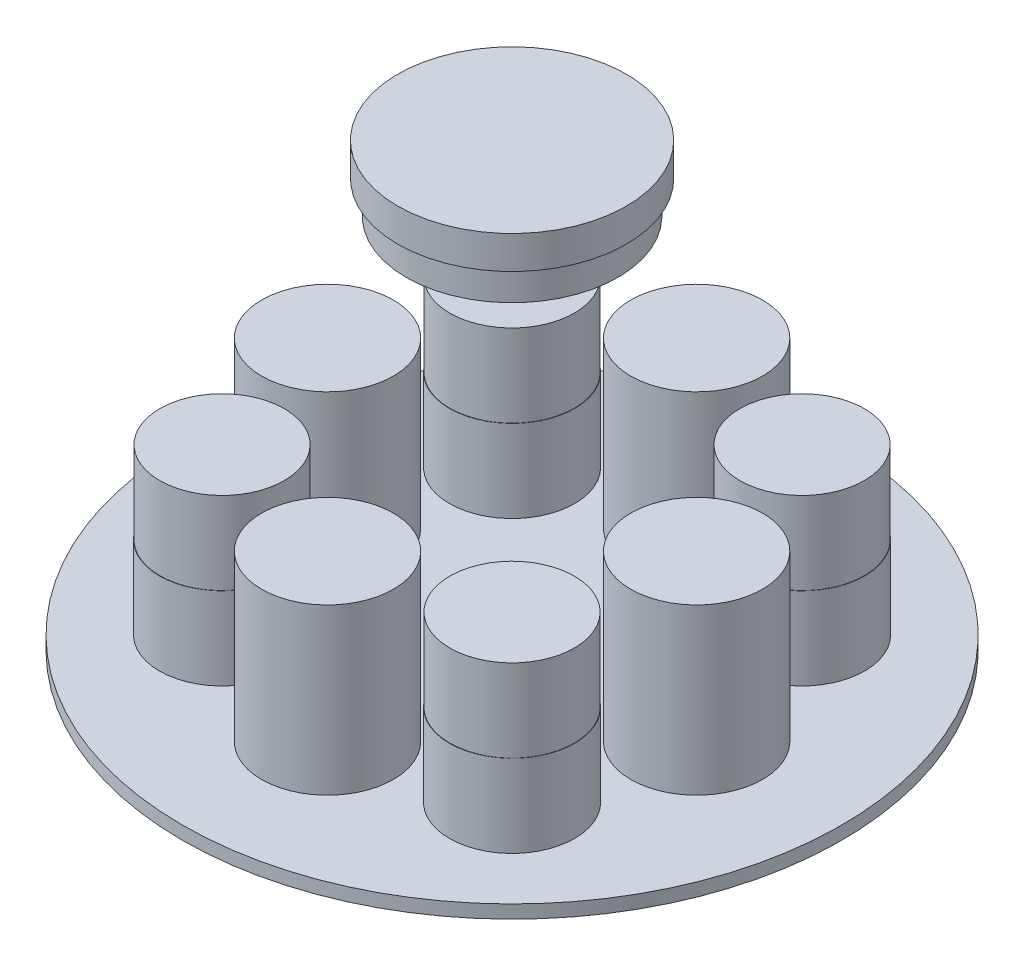
from build123d import *

# Parameters (mm, degrees)
SKETCH1_R           = 50
BOSS_EXTRUDE1_DEPTH = 2
SKETCH2_R           = 10
BOSS_EXTRUDE2_DEPTH = 25
SKETCH2_3_R         = 9.5
BOSS_EXTRUDE3_DEPTH = 12.5
SKETCH5_R           = 9.45
BOSS_EXTRUDE4_DEPTH = 12.5
SKETCH6_R           = 16.071329463
BOSS_EXTRUDE5_DEPTH = 5
SKETCH7_R           = 17.345412176
BOSS_EXTRUDE6_DEPTH = 5


with BuildPart() as part:
    # Sketch1 → Boss-Extrude1 (new body)
    with BuildSketch(Plane(origin=(0, 0, 0), x_dir=(1, 0, 0), z_dir=(0, 1, 0))):
        Circle(SKETCH1_R)
    extrude(amount=BOSS_EXTRUDE1_DEPTH)

    # Sketch2 → Boss-Extrude2 (add)
    with BuildSketch(Plane(origin=(0, 2, 0), x_dir=(1, 0, 0), z_dir=(0, 1, 0))):
        with Locations((28, 0)):
            Circle(SKETCH2_R)
        with Locations((0, 28)):
            Circle(SKETCH2_R)
        with Locations((-28, 0)):
            Circle(SKETCH2_R)
        with Locations((0, -28)):
            Circle(SKETCH2_R)
    extrude(amount=BOSS_EXTRUDE2_DEPTH)

    # Sketch2<3> → Boss-Extrude3 (add)
    with BuildSketch(Plane(origin=(0, 2, 0), x_dir=(1, 0, 0), z_dir=(0, 1, 0))):
        with Locations((22, -22)):
            Circle(SKETCH2_3_R)
        with Locations((-22, -22)):
            Circle(SKETCH2_3_R)
        with Locations((22, 22)):
            Circle(SKETCH2_3_R)
        with Locations((-22, 22)):
            Circle(SKETCH2_3_R)
    extrude(amount=BOSS_EXTRUDE3_DEPTH)

    # Sketch5 → Boss-Extrude4 (add)
    with BuildSketch(Plane(origin=(0, 14.5, 0), x_dir=(1, 0, 0), z_dir=(0, 1, 0))):
        with Locations((-22, -22)):
            Circle(SKETCH5_R)
        with Locations((22, 22)):
            Circle(SKETCH5_R)
        with Locations((22, -22)):
            Circle(SKETCH5_R)
        with Locations((-22, 22)):
            Circle(SKETCH5_R)
    extrude(amount=BOSS_EXTRUDE4_DEPTH)


with BuildPart() as body_2:
    # Sketch6 → Boss-Extrude5 (new body)
    with BuildSketch(Plane(origin=(0, 57, 0), x_dir=(1, 0, 0), z_dir=(0, 1, 0))):
        Circle(SKETCH6_R)
    extrude(amount=BOSS_EXTRUDE5_DEPTH)

    # Sketch7 → Boss-Extrude6 (add)
    with BuildSketch(Plane(origin=(0, 62, 0), x_dir=(1, 0, 0), z_dir=(0, 1, 0))):
        Circle(SKETCH7_R)
    extrude(amount=BOSS_EXTRUDE6_DEPTH)


solid = Compound([part.part, body_2.part])
